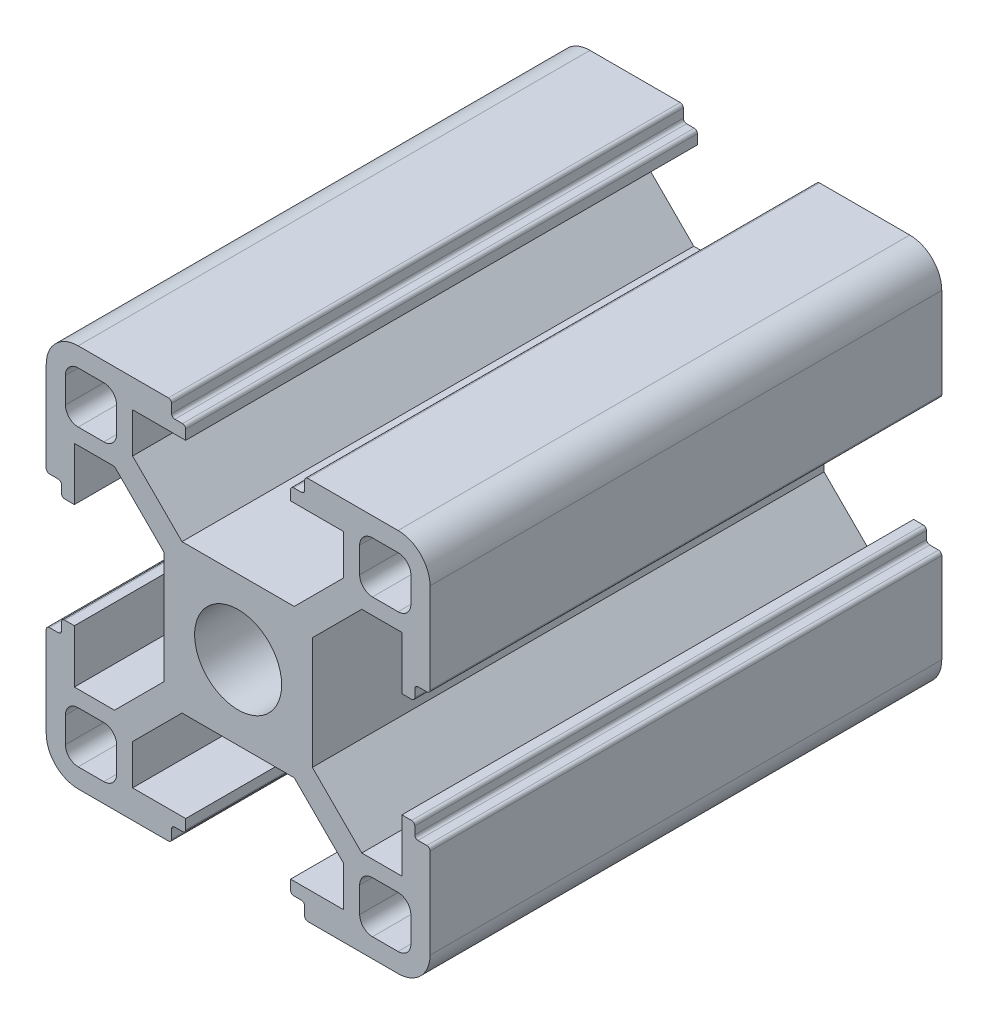
from build123d import *

# Parameters (mm, degrees)
BOSS_EXTRUDE1_DEPTH = 250
SKETCH2_R           = 3.4
CUT_EXTRUDE1_DEPTH  = 251.898385806
FILLET1_R           = 2.5
FILLET2_R           = 0.25
CUT_EXTRUDE3_START  = -210
SKETCH3_R           = 3.4
CUT_EXTRUDE3_DEPTH  = 210


with BuildPart() as part:
    # Sketch1 → Boss-Extrude1 (new body)
    with BuildSketch(Plane.XY):
        Polygon((-15, 15), (-5.2, 15), (-5.2, 13.808325472), (-4.1, 13.808325472), (-4.1, 12.8), (-8.25, 12.8), (-8.25, 9.664213562), (-4.385786438, 5.8), (4.385786438, 5.8), (8.25, 9.664213562), (8.25, 12.8), (4.1, 12.8), (4.1, 13.808325472), (5.2, 13.808325472), (5.2, 15), (15, 15), (15, 5.2), (13.808325472, 5.2), (13.808325472, 4.1), (12.8, 4.1), (12.8, 8.25), (9.664213562, 8.25), (5.8, 4.385786438), (5.8, -4.385786438), (9.664213562, -8.25), (12.8, -8.25), (12.8, -4.1), (13.808325472, -4.1), (13.808325472, -5.2), (15, -5.2), (15, -15), (5.2, -15), (5.2, -13.808325472), (4.1, -13.808325472), (4.1, -12.8), (8.25, -12.8), (8.25, -9.664213562), (4.385786438, -5.8), (-4.385786438, -5.8), (-8.25, -9.664213562), (-8.25, -12.8), (-4.1, -12.8), (-4.1, -13.808325472), (-5.2, -13.808325472), (-5.2, -15), (-15, -15), (-15, -5.2), (-13.808325472, -5.2), (-13.808325472, -4.1), (-12.8, -4.1), (-12.8, -8.25), (-9.664213562, -8.25), (-5.8, -4.385786438), (-5.8, 4.385786438), (-9.664213562, 8.25), (-12.8, 8.25), (-12.8, 4.1), (-13.808325472, 4.1), (-13.808325472, 5.2), (-15, 5.2), align=None)
    extrude(amount=BOSS_EXTRUDE1_DEPTH)

    # Sketch2 → Cut-Extrude1 (cut, through all)
    with BuildSketch(Plane.XY.offset(250)):
        Circle(SKETCH2_R)
        with BuildLine():
            Line((-12.5, 13.5), (-10.5, 13.5))
            ThreePointArc((-10.5, 13.5), (-9.792893219, 13.207106781), (-9.5, 12.5))
            Line((-9.5, 12.5), (-9.5, 10.5))
            ThreePointArc((-9.5, 10.5), (-9.792893219, 9.792893219), (-10.5, 9.5))
            Line((-10.5, 9.5), (-12.5, 9.5))
            ThreePointArc((-12.5, 9.5), (-13.207106781, 9.792893219), (-13.5, 10.5))
            Line((-13.5, 10.5), (-13.5, 12.5))
            ThreePointArc((-13.5, 12.5), (-13.207106781, 13.207106781), (-12.5, 13.5))
        make_face()
        with BuildLine():
            Line((9.5, 12.5), (9.5, 10.5))
            ThreePointArc((9.5, 10.5), (9.792893219, 9.792893219), (10.5, 9.5))
            Line((10.5, 9.5), (12.5, 9.5))
            ThreePointArc((12.5, 9.5), (13.207106781, 9.792893219), (13.5, 10.5))
            Line((13.5, 10.5), (13.5, 12.5))
            ThreePointArc((13.5, 12.5), (13.207106781, 13.207106781), (12.5, 13.5))
            Line((12.5, 13.5), (10.5, 13.5))
            ThreePointArc((10.5, 13.5), (9.792893219, 13.207106781), (9.5, 12.5))
        make_face()
        with BuildLine():
            Line((12.5, -13.5), (10.5, -13.5))
            ThreePointArc((10.5, -13.5), (9.792893219, -13.207106781), (9.5, -12.5))
            Line((9.5, -12.5), (9.5, -10.5))
            ThreePointArc((9.5, -10.5), (9.792893219, -9.792893219), (10.5, -9.5))
            Line((10.5, -9.5), (12.5, -9.5))
            ThreePointArc((12.5, -9.5), (13.207106781, -9.792893219), (13.5, -10.5))
            Line((13.5, -10.5), (13.5, -12.5))
            ThreePointArc((13.5, -12.5), (13.207106781, -13.207106781), (12.5, -13.5))
        make_face()
        with BuildLine():
            Line((-9.5, -12.5), (-9.5, -10.5))
            ThreePointArc((-9.5, -10.5), (-9.792893219, -9.792893219), (-10.5, -9.5))
            Line((-10.5, -9.5), (-12.5, -9.5))
            ThreePointArc((-12.5, -9.5), (-13.207106781, -9.792893219), (-13.5, -10.5))
            Line((-13.5, -10.5), (-13.5, -12.5))
            ThreePointArc((-13.5, -12.5), (-13.207106781, -13.207106781), (-12.5, -13.5))
            Line((-12.5, -13.5), (-10.5, -13.5))
            ThreePointArc((-10.5, -13.5), (-9.792893219, -13.207106781), (-9.5, -12.5))
        make_face()
    extrude(amount=-CUT_EXTRUDE1_DEPTH, mode=Mode.SUBTRACT)

    # Fillet1
    fillet1_edges = [part.edges().sort_by_distance(p)[0] for p in [
        (15, -15, 125),
        (-15, -15, 125),
        (-15, 15, 125),
        (15, 15, 125),
    ]]
    fillet(fillet1_edges, radius=FILLET1_R)

    # Fillet2
    fillet2_edges = [part.edges().sort_by_distance(p)[0] for p in [
        (5.2, -15, 125),
        (5.2, -13.808325472, 125),
        (4.1, -13.808325472, 125),
        (-4.1, -13.808325472, 125),
        (-5.2, -13.808325472, 125),
        (-5.2, -15, 125),
        (-15, -5.2, 125),
        (-13.808325472, -5.2, 125),
        (-13.808325472, -4.1, 125),
        (-13.808325472, 4.1, 125),
        (-13.808325472, 5.2, 125),
        (-15, 5.2, 125),
        (-5.2, 15, 125),
        (-5.2, 13.808325472, 125),
        (-4.1, 13.808325472, 125),
        (4.1, 13.808325472, 125),
        (5.2, 13.808325472, 125),
        (5.2, 15, 125),
        (15, 5.2, 125),
        (13.808325472, 5.2, 125),
        (13.808325472, 4.1, 125),
        (13.808325472, -4.1, 125),
        (13.808325472, -5.2, 125),
        (15, -5.2, 125),
    ]]
    fillet(fillet2_edges, radius=FILLET2_R)

    # Sketch3 → Cut-Extrude3 (cut)
    with BuildSketch(Plane(origin=(0, 0, 0), x_dir=(-1, 0, 0), z_dir=(0, 0, -1)).offset(CUT_EXTRUDE3_START)):
        with BuildLine():
            Line((12.8, 4.1), (13.558325472, 4.1))
            ThreePointArc((13.558325472, 4.1), (13.735102167, 4.173223305), (13.808325472, 4.35))
            Line((13.808325472, 4.35), (13.808325472, 4.95))
            ThreePointArc((13.808325472, 4.95), (13.881548777, 5.126776695), (14.058325472, 5.2))
            Line((14.058325472, 5.2), (14.75, 5.2))
            ThreePointArc((14.75, 5.2), (14.926776695, 5.273223305), (15, 5.45))
            Line((15, 5.45), (15, 12.5))
            ThreePointArc((15, 12.5), (14.267766953, 14.267766953), (12.5, 15))
            Line((12.5, 15), (5.45, 15))
            ThreePointArc((5.45, 15), (5.273223305, 14.926776695), (5.2, 14.75))
            Line((5.2, 14.75), (5.2, 14.058325472))
            ThreePointArc((5.2, 14.058325472), (5.126776695, 13.881548777), (4.95, 13.808325472))
            Line((4.95, 13.808325472), (4.35, 13.808325472))
            ThreePointArc((4.35, 13.808325472), (4.173223305, 13.735102167), (4.1, 13.558325472))
            Line((4.1, 13.558325472), (4.1, 12.8))
            Line((4.1, 12.8), (8.25, 12.8))
            Line((8.25, 12.8), (8.25, 9.664213562))
            Line((8.25, 9.664213562), (4.385786438, 5.8))
            Line((4.385786438, 5.8), (-4.385786438, 5.8))
            Line((-4.385786438, 5.8), (-8.25, 9.664213562))
            Line((-8.25, 9.664213562), (-8.25, 12.8))
            Line((-8.25, 12.8), (-4.1, 12.8))
            Line((-4.1, 12.8), (-4.1, 13.558325472))
            ThreePointArc((-4.1, 13.558325472), (-4.173223305, 13.735102167), (-4.35, 13.808325472))
            Line((-4.35, 13.808325472), (-4.95, 13.808325472))
            ThreePointArc((-4.95, 13.808325472), (-5.126776695, 13.881548777), (-5.2, 14.058325472))
            Line((-5.2, 14.058325472), (-5.2, 14.75))
            ThreePointArc((-5.2, 14.75), (-5.273223305, 14.926776695), (-5.45, 15))
            Line((-5.45, 15), (-12.5, 15))
            ThreePointArc((-12.5, 15), (-14.267766953, 14.267766953), (-15, 12.5))
            Line((-15, 12.5), (-15, 5.45))
            ThreePointArc((-15, 5.45), (-14.926776695, 5.273223305), (-14.75, 5.2))
            Line((-14.75, 5.2), (-14.058325472, 5.2))
            ThreePointArc((-14.058325472, 5.2), (-13.881548777, 5.126776695), (-13.808325472, 4.95))
            Line((-13.808325472, 4.95), (-13.808325472, 4.35))
            ThreePointArc((-13.808325472, 4.35), (-13.735102167, 4.173223305), (-13.558325472, 4.1))
            Line((-13.558325472, 4.1), (-12.8, 4.1))
            Line((-12.8, 4.1), (-12.8, 8.25))
            Line((-12.8, 8.25), (-9.664213562, 8.25))
            Line((-9.664213562, 8.25), (-5.8, 4.385786438))
            Line((-5.8, 4.385786438), (-5.8, -4.385786438))
            Line((-5.8, -4.385786438), (-9.664213562, -8.25))
            Line((-9.664213562, -8.25), (-12.8, -8.25))
            Line((-12.8, -8.25), (-12.8, -4.1))
            Line((-12.8, -4.1), (-13.558325472, -4.1))
            ThreePointArc((-13.558325472, -4.1), (-13.735102167, -4.173223305), (-13.808325472, -4.35))
            Line((-13.808325472, -4.35), (-13.808325472, -4.95))
            ThreePointArc((-13.808325472, -4.95), (-13.881548777, -5.126776695), (-14.058325472, -5.2))
            Line((-14.058325472, -5.2), (-14.75, -5.2))
            ThreePointArc((-14.75, -5.2), (-14.926776695, -5.273223305), (-15, -5.45))
            Line((-15, -5.45), (-15, -12.5))
            ThreePointArc((-15, -12.5), (-14.267766953, -14.267766953), (-12.5, -15))
            Line((-12.5, -15), (-5.45, -15))
            ThreePointArc((-5.45, -15), (-5.273223305, -14.926776695), (-5.2, -14.75))
            Line((-5.2, -14.75), (-5.2, -14.058325472))
            ThreePointArc((-5.2, -14.058325472), (-5.126776695, -13.881548777), (-4.95, -13.808325472))
            Line((-4.95, -13.808325472), (-4.35, -13.808325472))
            ThreePointArc((-4.35, -13.808325472), (-4.173223305, -13.735102167), (-4.1, -13.558325472))
            Line((-4.1, -13.558325472), (-4.1, -12.8))
            Line((-4.1, -12.8), (-8.25, -12.8))
            Line((-8.25, -12.8), (-8.25, -9.664213562))
            Line((-8.25, -9.664213562), (-4.385786438, -5.8))
            Line((-4.385786438, -5.8), (4.385786438, -5.8))
            Line((4.385786438, -5.8), (8.25, -9.664213562))
            Line((8.25, -9.664213562), (8.25, -12.8))
            Line((8.25, -12.8), (4.1, -12.8))
            Line((4.1, -12.8), (4.1, -13.558325472))
            ThreePointArc((4.1, -13.558325472), (4.173223305, -13.735102167), (4.35, -13.808325472))
            Line((4.35, -13.808325472), (4.95, -13.808325472))
            ThreePointArc((4.95, -13.808325472), (5.126776695, -13.881548777), (5.2, -14.058325472))
            Line((5.2, -14.058325472), (5.2, -14.75))
            ThreePointArc((5.2, -14.75), (5.273223305, -14.926776695), (5.45, -15))
            Line((5.45, -15), (12.5, -15))
            ThreePointArc((12.5, -15), (14.267766953, -14.267766953), (15, -12.5))
            Line((15, -12.5), (15, -5.45))
            ThreePointArc((15, -5.45), (14.926776695, -5.273223305), (14.75, -5.2))
            Line((14.75, -5.2), (14.058325472, -5.2))
            ThreePointArc((14.058325472, -5.2), (13.881548777, -5.126776695), (13.808325472, -4.95))
            Line((13.808325472, -4.95), (13.808325472, -4.35))
            ThreePointArc((13.808325472, -4.35), (13.735102167, -4.173223305), (13.558325472, -4.1))
            Line((13.558325472, -4.1), (12.8, -4.1))
            Line((12.8, -4.1), (12.8, -8.25))
            Line((12.8, -8.25), (9.664213562, -8.25))
            Line((9.664213562, -8.25), (5.8, -4.385786438))
            Line((5.8, -4.385786438), (5.8, 4.385786438))
            Line((5.8, 4.385786438), (9.664213562, 8.25))
            Line((9.664213562, 8.25), (12.8, 8.25))
            Line((12.8, 8.25), (12.8, 4.1))
        make_face()
        with Locations(Location((0, 0, 0), (0, 0, 180))):
            Circle(SKETCH3_R, mode=Mode.SUBTRACT)
        with BuildLine():
            Line((-9.5, 12.5), (-9.5, 10.5))
            ThreePointArc((-9.5, 10.5), (-9.792893219, 9.792893219), (-10.5, 9.5))
            Line((-10.5, 9.5), (-12.5, 9.5))
            ThreePointArc((-12.5, 9.5), (-13.207106781, 9.792893219), (-13.5, 10.5))
            Line((-13.5, 10.5), (-13.5, 12.5))
            ThreePointArc((-13.5, 12.5), (-13.207106781, 13.207106781), (-12.5, 13.5))
            Line((-12.5, 13.5), (-10.5, 13.5))
            ThreePointArc((-10.5, 13.5), (-9.792893219, 13.207106781), (-9.5, 12.5))
        make_face(mode=Mode.SUBTRACT)
        with BuildLine():
            Line((12.5, 9.5), (10.5, 9.5))
            ThreePointArc((10.5, 9.5), (9.792893219, 9.792893219), (9.5, 10.5))
            Line((9.5, 10.5), (9.5, 12.5))
            ThreePointArc((9.5, 12.5), (9.792893219, 13.207106781), (10.5, 13.5))
            Line((10.5, 13.5), (12.5, 13.5))
            ThreePointArc((12.5, 13.5), (13.207106781, 13.207106781), (13.5, 12.5))
            Line((13.5, 12.5), (13.5, 10.5))
            ThreePointArc((13.5, 10.5), (13.207106781, 9.792893219), (12.5, 9.5))
        make_face(mode=Mode.SUBTRACT)
        with BuildLine():
            Line((9.5, -12.5), (9.5, -10.5))
            ThreePointArc((9.5, -10.5), (9.792893219, -9.792893219), (10.5, -9.5))
            Line((10.5, -9.5), (12.5, -9.5))
            ThreePointArc((12.5, -9.5), (13.207106781, -9.792893219), (13.5, -10.5))
            Line((13.5, -10.5), (13.5, -12.5))
            ThreePointArc((13.5, -12.5), (13.207106781, -13.207106781), (12.5, -13.5))
            Line((12.5, -13.5), (10.5, -13.5))
            ThreePointArc((10.5, -13.5), (9.792893219, -13.207106781), (9.5, -12.5))
        make_face(mode=Mode.SUBTRACT)
        with BuildLine():
            Line((-9.5, -10.5), (-9.5, -12.5))
            ThreePointArc((-9.5, -12.5), (-9.792893219, -13.207106781), (-10.5, -13.5))
            Line((-10.5, -13.5), (-12.5, -13.5))
            ThreePointArc((-12.5, -13.5), (-13.207106781, -13.207106781), (-13.5, -12.5))
            Line((-13.5, -12.5), (-13.5, -10.5))
            ThreePointArc((-13.5, -10.5), (-13.207106781, -9.792893219), (-12.5, -9.5))
            Line((-12.5, -9.5), (-10.5, -9.5))
            ThreePointArc((-10.5, -9.5), (-9.792893219, -9.792893219), (-9.5, -10.5))
        make_face(mode=Mode.SUBTRACT)
    extrude(amount=CUT_EXTRUDE3_DEPTH, mode=Mode.SUBTRACT)


solid = part.part
